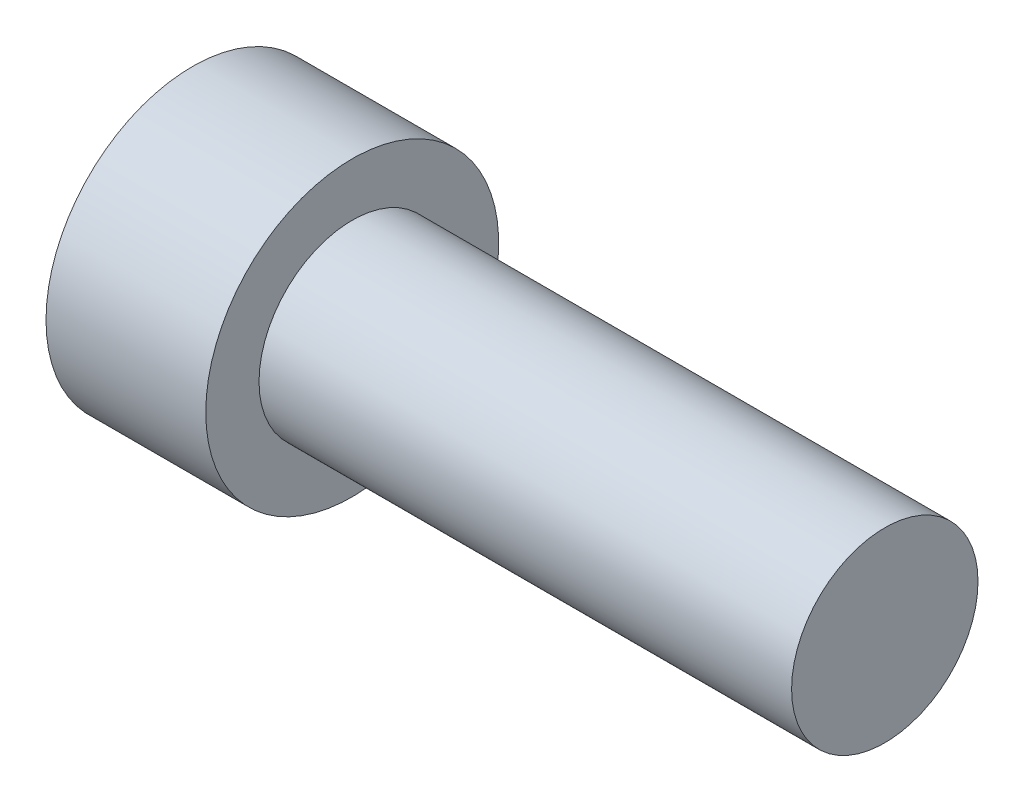
from build123d import *

# Parameters (mm, degrees)
SKETCH1_R             = 1.75
THREADED_SCREW_DEPTH  = 10
SKETCH2_R             = 2.75
ROUND_HEAD_DEPTH      = 3
HEX_SOCKET_SIZE_DEPTH = 2


with BuildPart() as part:
    # Sketch1 → Threaded_Screw (new body)
    with BuildSketch(Plane(origin=(0, 0, 0), x_dir=(0, 0, -1), z_dir=(1, 0, 0))):
        Circle(SKETCH1_R)
    extrude(amount=THREADED_SCREW_DEPTH)

    # Sketch2 → Round_Head (add)
    with BuildSketch(Plane.ZY):
        Circle(SKETCH2_R)
    extrude(amount=ROUND_HEAD_DEPTH)

    # Sketch3 → Hex_Socket_Size (cut)
    with BuildSketch(Plane.ZY.offset(3)):
        Polygon((1.25, -0.721687836), (1.25, 0.721687836), (0, 1.443375673), (-1.25, 0.721687836), (-1.25, -0.721687836), (0, -1.443375673), align=None)
    extrude(amount=-HEX_SOCKET_SIZE_DEPTH, mode=Mode.SUBTRACT)


solid = part.part
